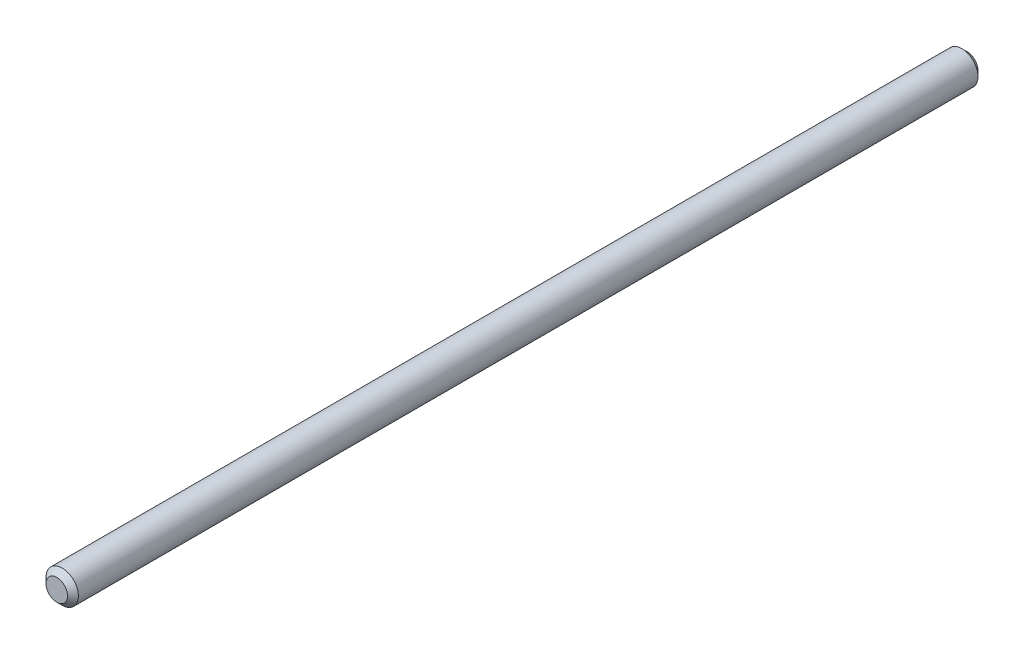
from build123d import *

# Parameters (mm, degrees)
SKETCH1_R           = 1.5
BOSS_EXTRUDE1_DEPTH = 84.4
CHAMFER1_SIZE       = 0.5


with BuildPart() as part:
    # Sketch1 → Boss-Extrude1 (new body)
    with BuildSketch(Plane(origin=(0, 0, 0), x_dir=(0, 1, 0), z_dir=(0, 0, 1))):
        with Locations(Location((0, 0, 0), (0, 0, 270))):
            Circle(SKETCH1_R)
    extrude(amount=BOSS_EXTRUDE1_DEPTH)

    # Chamfer1
    chamfer1_edges = [part.edges().sort_by_distance(p)[0] for p in [
        (-1.5, 0, 0),
        (-1.5, 0, 84.4),
    ]]
    chamfer(chamfer1_edges, length=CHAMFER1_SIZE)


solid = part.part
